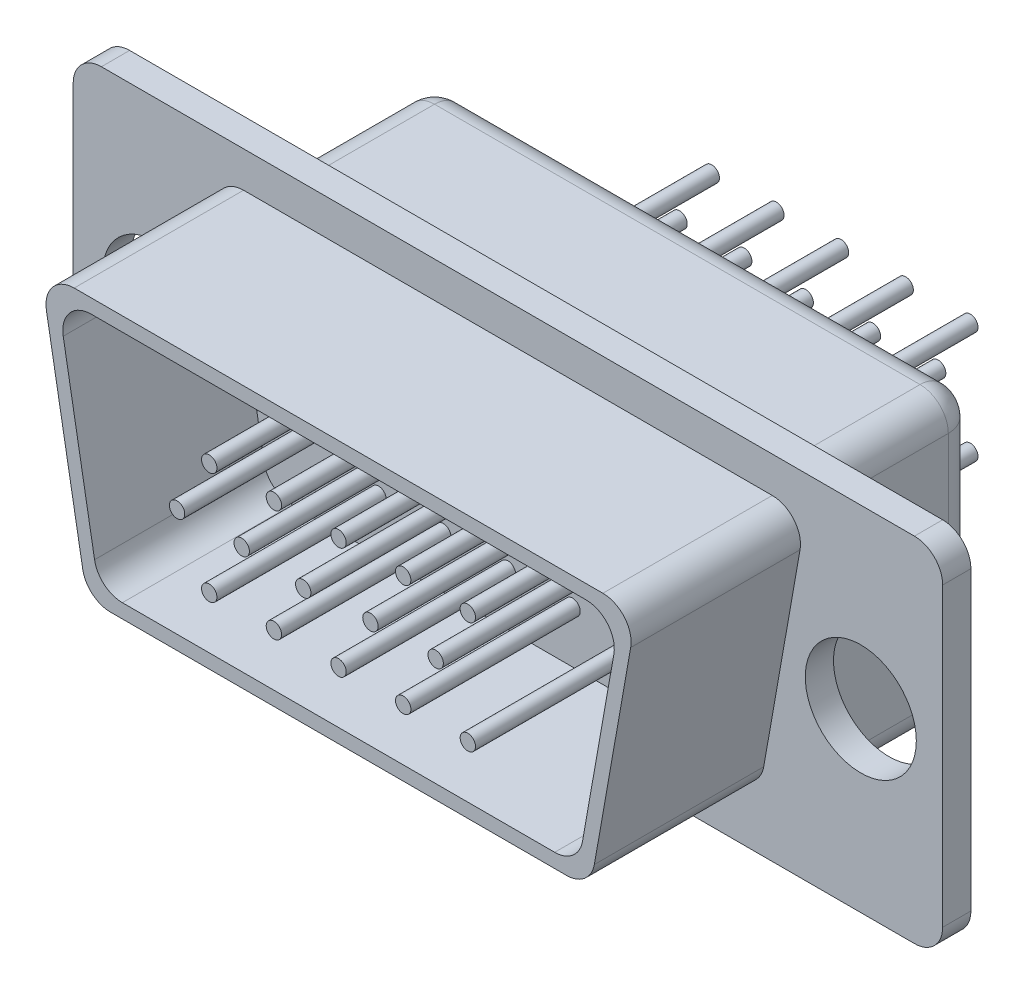
from build123d import *

# Parameters (mm, degrees)
ESQUISSE1_W      = 30.8
ESQUISSE1_H      = 12.5
ESQUISSE1_R      = 1.847277142
ESQUISSE1_R_2    = 1.96687405
EXTRUSION1_DEPTH = 1
EXTRUSION2_DEPTH = 6
ESQUISSE3_W      = 19.2
ESQUISSE3_H      = 10
EXTRUSION3_DEPTH = 6
ESQUISSE4_R      = 0.272537765
EXTRUSION4_DEPTH = 4.8
CONG_1_R         = 1
EXTRUSION6_START = 6
ESQUISSE7_R      = 0.272537765
EXTRUSION6_DEPTH = 6


with BuildPart() as part:
    # Esquisse1 → Extrusion1 (new body)
    with BuildSketch(Plane.XY):
        with Locations((15.4, 6.25)):
            Rectangle(ESQUISSE1_W, ESQUISSE1_H)
        with Locations((2.9, 6.25)):
            Circle(ESQUISSE1_R, mode=Mode.SUBTRACT)
        with Locations((27.9, 6.25)):
            Circle(ESQUISSE1_R_2, mode=Mode.SUBTRACT)
    extrude(amount=EXTRUSION1_DEPTH)

    # Esquisse2 → Extrusion2 (add)
    with BuildSketch(Plane.XY.offset(1)):
        with BuildLine():
            Line((6.035876796, 11.229075796), (24.764123204, 11.229075796))
            ThreePointArc((24.764123204, 11.229075796), (25.530167647, 10.871863406), (25.748930957, 10.055427619))
            Line((25.748930957, 10.055427619), (24.461743998, 2.755427619))
            ThreePointArc((24.461743998, 2.755427619), (24.119723854, 2.163031353), (23.476936245, 1.929075796))
            Line((23.476936245, 1.929075796), (7.323063755, 1.929075796))
            ThreePointArc((7.323063755, 1.929075796), (6.680276146, 2.163031353), (6.338256002, 2.755427619))
            Line((6.338256002, 2.755427619), (5.051069043, 10.055427619))
            ThreePointArc((5.051069043, 10.055427619), (5.269832353, 10.871863406), (6.035876796, 11.229075796))
        make_face()
        with BuildLine():
            Line((6.631753593, 10.729075796), (24.168246407, 10.729075796))
            ThreePointArc((24.168246407, 10.729075796), (24.934290851, 10.371863406), (25.15305416, 9.555427619))
            Line((25.15305416, 9.555427619), (24.042194182, 3.255427619))
            ThreePointArc((24.042194182, 3.255427619), (23.700174039, 2.663031353), (23.057386429, 2.429075796))
            Line((23.057386429, 2.429075796), (7.742613571, 2.429075796))
            ThreePointArc((7.742613571, 2.429075796), (7.099825961, 2.663031353), (6.757805818, 3.255427619))
            Line((6.757805818, 3.255427619), (5.64694584, 9.555427619))
            ThreePointArc((5.64694584, 9.555427619), (5.865709149, 10.371863406), (6.631753593, 10.729075796))
        make_face(mode=Mode.SUBTRACT)
    extrude(amount=EXTRUSION2_DEPTH)

    # Esquisse3 → Extrusion3 (add)
    with BuildSketch(Plane(origin=(0, 0, 0), x_dir=(-1, 0, 0), z_dir=(0, 0, -1))):
        with Locations((-15.4, 6.25)):
            Rectangle(ESQUISSE3_W, ESQUISSE3_H)
    extrude(amount=EXTRUSION3_DEPTH)

    # Esquisse4 → Extrusion4 (add)
    with BuildSketch(Plane(origin=(0, 0, -6), x_dir=(-1, 0, 0), z_dir=(0, 0, -1))):
        with Locations((-19.98, 8.23)):
            Circle(ESQUISSE4_R)
        with Locations((-17.69, 8.23)):
            Circle(ESQUISSE4_R)
        with Locations((-15.4, 8.23)):
            Circle(ESQUISSE4_R)
        with Locations((-13.11, 8.23)):
            Circle(ESQUISSE4_R)
        with Locations((-10.82, 8.23)):
            Circle(ESQUISSE4_R)
        with Locations((-9.68, 6.25)):
            Circle(ESQUISSE4_R)
        with Locations((-11.97, 6.25)):
            Circle(ESQUISSE4_R)
        with Locations((-14.149725584, 6.068095869)):
            Circle(ESQUISSE4_R)
        with Locations((-16.529732269, 6.22882427)):
            Circle(ESQUISSE4_R)
        with Locations((-18.84, 6.25)):
            Circle(ESQUISSE4_R)
        with Locations((-19.98, 4.27)):
            Circle(ESQUISSE4_R)
        with Locations((-17.69, 4.27)):
            Circle(ESQUISSE4_R)
        with Locations((-15.4, 4.27)):
            Circle(ESQUISSE4_R)
        with Locations((-13.11, 4.27)):
            Circle(ESQUISSE4_R)
        with Locations((-10.82, 4.27)):
            Circle(ESQUISSE4_R)
    extrude(amount=EXTRUSION4_DEPTH)

    # Congé1
    cong_1_edges = [part.edges().sort_by_distance(p)[0] for p in [
        (25, 11.25, -3),
        (25, 1.25, -3),
        (5.8, 1.25, -3),
        (5.8, 11.25, -3),
        (25, 6.25, -6),
        (15.4, 1.25, -6),
        (5.8, 6.25, -6),
        (15.4, 11.25, -6),
        (0, 12.5, 0.5),
        (30.8, 12.5, 0.5),
        (30.8, 0, 0.5),
        (0, 0, 0.5),
    ]]
    fillet(cong_1_edges, radius=CONG_1_R)

    # Esquisse7 → Extrusion6 (add)
    with BuildSketch(Plane.XY.offset(1).offset(EXTRUSION6_START)):
        with Locations(Location((19.98, 8.23, 0), (0, 0, 180))):
            Circle(ESQUISSE7_R)
        with Locations(Location((17.69, 8.23, 0), (0, 0, 180))):
            Circle(ESQUISSE7_R)
        with Locations(Location((15.4, 8.23, 0), (0, 0, 180))):
            Circle(ESQUISSE7_R)
        with Locations(Location((13.11, 8.23, 0), (0, 0, 180))):
            Circle(ESQUISSE7_R)
        with Locations(Location((10.82, 8.23, 0), (0, 0, 180))):
            Circle(ESQUISSE7_R)
        with Locations(Location((9.68, 6.25, 0), (0, 0, 180))):
            Circle(ESQUISSE7_R)
        with Locations(Location((11.97, 6.25, 0), (0, 0, 180))):
            Circle(ESQUISSE7_R)
        with Locations(Location((14.149725584, 6.068095869, 0), (0, 0, 180))):
            Circle(ESQUISSE7_R)
        with Locations(Location((16.529732269, 6.22882427, 0), (0, 0, 180))):
            Circle(ESQUISSE7_R)
        with Locations(Location((18.84, 6.25, 0), (0, 0, 180))):
            Circle(ESQUISSE7_R)
        with Locations(Location((19.98, 4.27, 0), (0, 0, 180))):
            Circle(ESQUISSE7_R)
        with Locations(Location((17.69, 4.27, 0), (0, 0, 180))):
            Circle(ESQUISSE7_R)
        with Locations(Location((15.4, 4.27, 0), (0, 0, 180))):
            Circle(ESQUISSE7_R)
        with Locations(Location((13.11, 4.27, 0), (0, 0, 180))):
            Circle(ESQUISSE7_R)
        with Locations(Location((10.82, 4.27, 0), (0, 0, 180))):
            Circle(ESQUISSE7_R)
    extrude(amount=-EXTRUSION6_DEPTH)


solid = part.part
